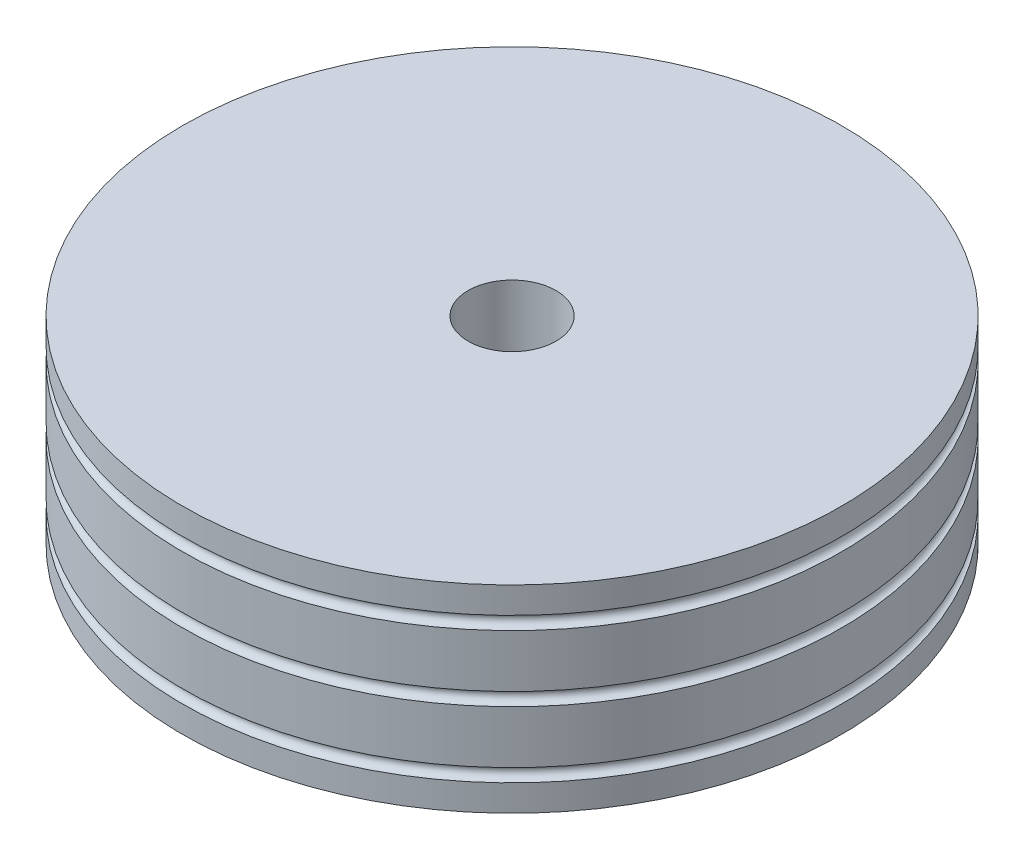
from build123d import *

# Parameters (mm, degrees)
SKETCH2_R          = 2
CUT_EXTRUDE1_DEPTH = 6
SKETCH9_R          = 3
CUT_EXTRUDE2_DEPTH = 3


with BuildPart() as part:
    # Sketch1 → Revolve2 (revolve)
    with BuildSketch(Plane.XY, mode=Mode.PRIVATE) as revolve2_sk:
        with BuildLine():
            Line((0, 4.5), (0, -4.5))
            Line((0, -4.5), (15, -4.5))
            Line((15, -4.5), (15, -3.3))
            ThreePointArc((15, -3.3), (14.7, -3), (15, -2.7))
            Line((15, -2.7), (15, -0.3))
            ThreePointArc((15, -0.3), (14.7, 0), (15, 0.3))
            Line((15, 0.3), (15, 2.7))
            ThreePointArc((15, 2.7), (14.7, 3), (15, 3.3))
            Line((15, 3.3), (15, 4.5))
            Line((15, 4.5), (0, 4.5))
        make_face()
    revolve(revolve2_sk.sketch.rotate(Axis((0, 4.5, 0), (0, -1, 0)), 180), axis=Axis((0, 4.5, 0), (0, -1, 0)))

    # Sketch2 → Cut-Extrude1 (cut)
    with BuildSketch(Plane(origin=(0, 4.5, 0), x_dir=(1, 0, 0), z_dir=(0, 1, 0))):
        with Locations(Location((0, 0, 0), (0, 0, 180))):
            Circle(SKETCH2_R)
    extrude(amount=-CUT_EXTRUDE1_DEPTH, mode=Mode.SUBTRACT)

    # Sketch9 → Cut-Extrude2 (cut)
    with BuildSketch(Plane.XZ.offset(4.5)):
        Circle(SKETCH9_R)
    extrude(amount=-CUT_EXTRUDE2_DEPTH, mode=Mode.SUBTRACT)


solid = part.part
